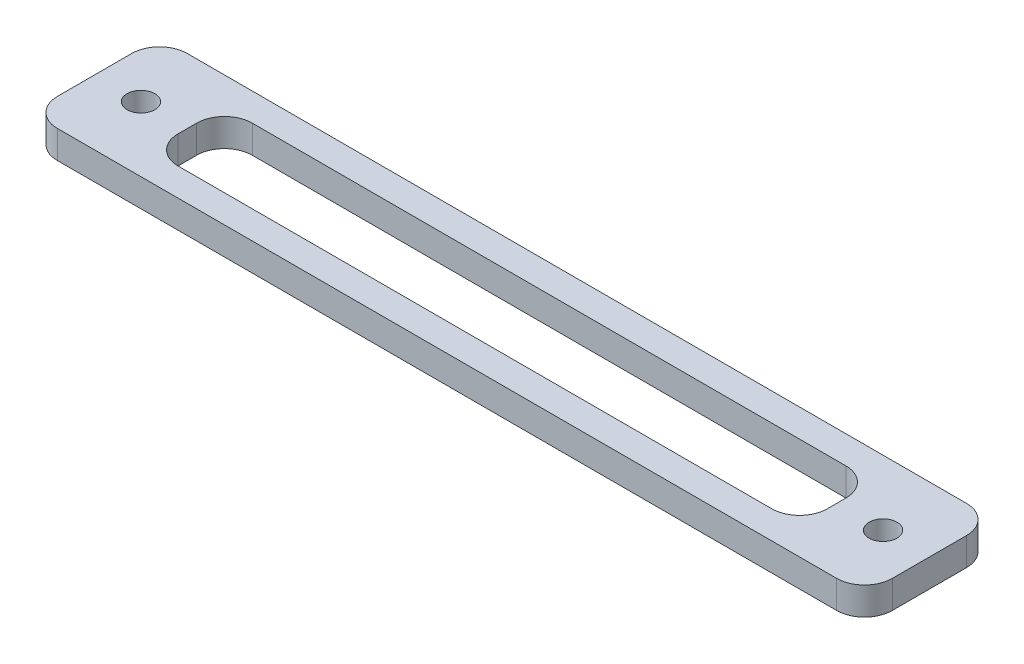
from build123d import *

# Parameters (mm, degrees)
SKETCH_1_W      = 90
SKETCH_1_H      = 14
SKETCH_1_R      = 1.5
SKETCH_1_W_2    = 70
SKETCH_1_H_2    = 8
EXTRUDE_1_DEPTH = 3
FILLET_1_R      = 3


with BuildPart() as part:
    # 草图1 → 凸台-拉伸1 (new body)
    with BuildSketch(Plane(origin=(0, 0, 0), x_dir=(1, 0, 0), z_dir=(0, 1, 0))):
        Rectangle(SKETCH_1_W, SKETCH_1_H)
        with Locations(Location((-40, 0, 0), (0, 0, 270))):
            Circle(SKETCH_1_R, mode=Mode.SUBTRACT)
        with Locations(Location((40, 0, 0), (0, 0, 90))):
            Circle(SKETCH_1_R, mode=Mode.SUBTRACT)
        Rectangle(SKETCH_1_W_2, SKETCH_1_H_2, mode=Mode.SUBTRACT)
    extrude(amount=EXTRUDE_1_DEPTH)

    # 圆角1
    fillet_1_edges = [part.edges().sort_by_distance(p)[0] for p in [
        (35, 1.5, 4),
        (35, 1.5, -4),
        (-35, 1.5, -4),
        (-35, 1.5, 4),
        (45, 1.5, 7),
        (-45, 1.5, 7),
        (-45, 1.5, -7),
        (45, 1.5, -7),
    ]]
    fillet(fillet_1_edges, radius=FILLET_1_R)


solid = part.part
